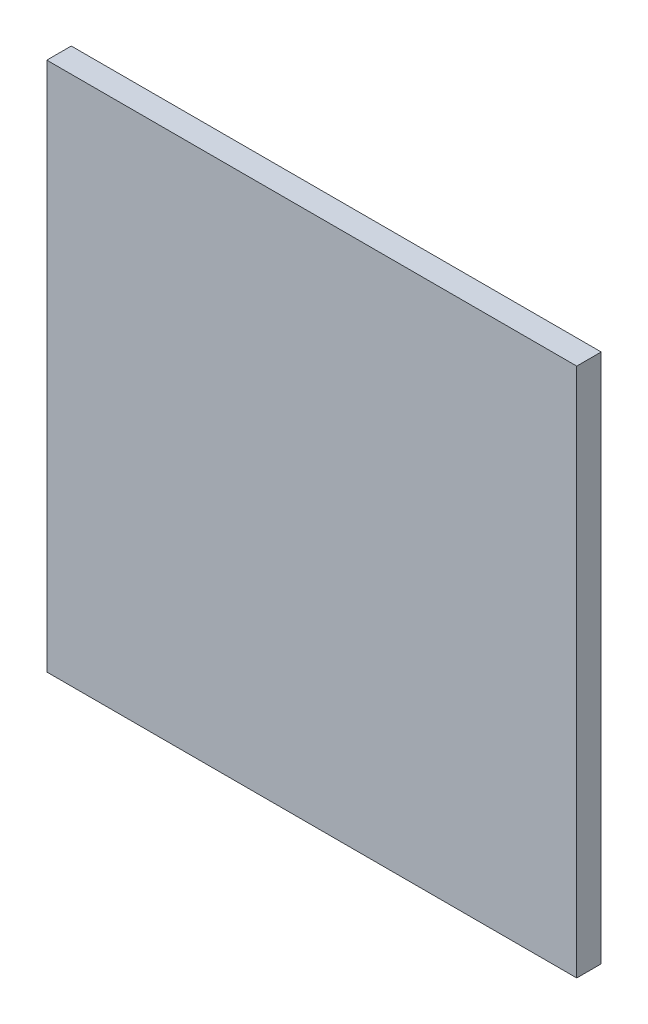
from build123d import *

# Parameters (mm, degrees)
SKETCH1_W           = 65
SKETCH1_H           = 65
BOSS_EXTRUDE1_DEPTH = 3


with BuildPart() as part:
    # Sketch1 → Boss-Extrude1 (new body)
    with BuildSketch(Plane.XY):
        Rectangle(SKETCH1_W, SKETCH1_H)
    extrude(amount=BOSS_EXTRUDE1_DEPTH)


solid = part.part
